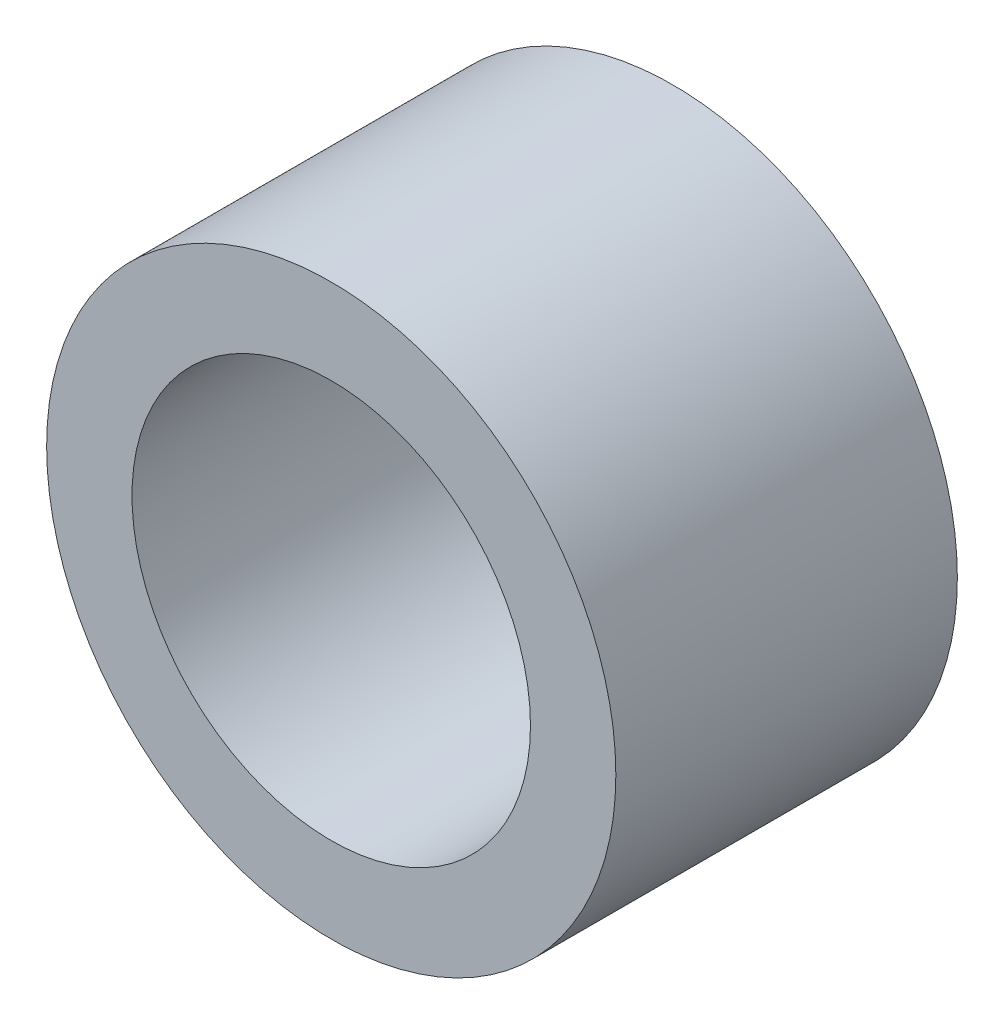
from build123d import *

# Parameters (mm, degrees)
SKETCH1_R           = 2.5
SKETCH1_R_2         = 1.75
BOSS_EXTRUDE1_DEPTH = 3


with BuildPart() as part:
    # Sketch1 → Boss-Extrude1 (new body)
    with BuildSketch(Plane.XY):
        with Locations((-5.908146187, 2.155020536)):
            Circle(SKETCH1_R)
        with Locations((-5.908146187, 2.155020536)):
            Circle(SKETCH1_R_2, mode=Mode.SUBTRACT)
    extrude(amount=BOSS_EXTRUDE1_DEPTH)


solid = part.part
